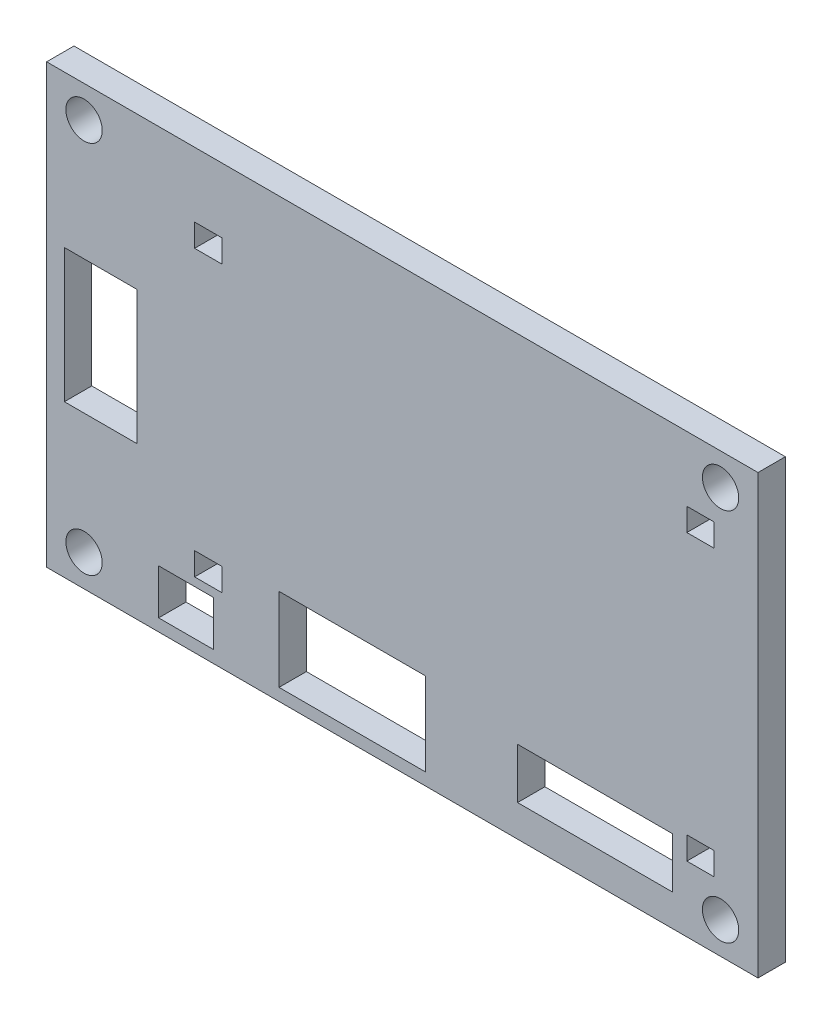
from build123d import *

# Parameters (mm, degrees)
SKETCH1_W           = 41.275
SKETCH1_H           = 25.4
SKETCH1_R           = 1.0541
BOSS_EXTRUDE1_DEPTH = 1.5875
SKETCH2_W           = 9
SKETCH2_H           = 2.93
SKETCH2_W_2         = 8.509
SKETCH2_H_2         = 4.826
SKETCH2_W_3         = 3.175
SKETCH2_H_3         = 2.6162
SKETCH2_W_4         = 4.22
SKETCH2_H_4         = 7.75
SKETCH2_W_5         = 1.5875
SKETCH2_H_5         = 1.3208
CUT_EXTRUDE1_DEPTH  = 1.5875


with BuildPart() as part:
    # Sketch1 → Boss-Extrude1 (new body)
    with BuildSketch(Plane.XY):
        with Locations((0, 12.7)):
            Rectangle(SKETCH1_W, SKETCH1_H)
        with Locations((-18.4658, 23.5585)):
            Circle(SKETCH1_R, mode=Mode.SUBTRACT)
        with Locations((-18.4658, 1.8415)):
            Circle(SKETCH1_R, mode=Mode.SUBTRACT)
        with Locations((18.4658, 1.8415)):
            Circle(SKETCH1_R, mode=Mode.SUBTRACT)
        with Locations((18.4658, 23.5585)):
            Circle(SKETCH1_R, mode=Mode.SUBTRACT)
    extrude(amount=BOSS_EXTRUDE1_DEPTH)

    # Sketch2 → Cut-Extrude1 (cut)
    with BuildSketch(Plane.XY.offset(1.5875)):
        with Locations((11.1858, 3.3045)):
            Rectangle(SKETCH2_W, SKETCH2_H)
        with Locations((-2.8993, 3.1205)):
            Rectangle(SKETCH2_W_2, SKETCH2_H_2)
        with Locations((-12.5513, 2.0156)):
            Rectangle(SKETCH2_W_3, SKETCH2_H_3)
        with Locations((-17.4978, 12.709)):
            Rectangle(SKETCH2_W_4, SKETCH2_H_4)
        with Locations((17.30375, 20.9804)):
            Rectangle(SKETCH2_W_5, SKETCH2_H_5)
        with Locations((17.30375, 4.4704)):
            Rectangle(SKETCH2_W_5, SKETCH2_H_5)
        with Locations((-11.25855, 4.4704)):
            Rectangle(SKETCH2_W_5, SKETCH2_H_5)
        with Locations((-11.25855, 20.9804)):
            Rectangle(SKETCH2_W_5, SKETCH2_H_5)
    extrude(amount=-CUT_EXTRUDE1_DEPTH, mode=Mode.SUBTRACT)


solid = part.part
